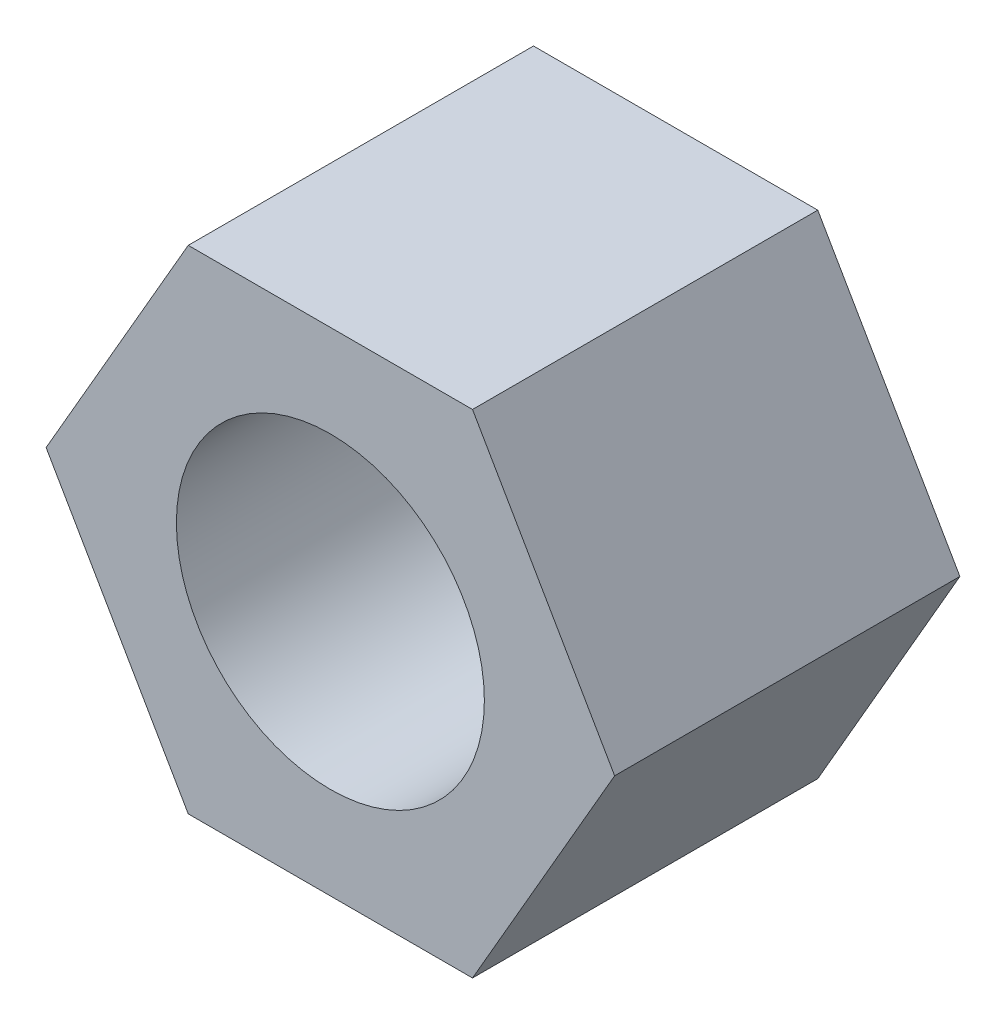
from build123d import *

# Parameters (mm, degrees)
SKETCH1_R           = 3.925
BOSS_EXTRUDE1_DEPTH = 8.8


with BuildPart() as part:
    # Sketch1 → Boss-Extrude1 (new body)
    with BuildSketch(Plane.XY):
        Polygon((3.622872939, -6.275), (7.245745878, 0), (3.622872939, 6.275), (-3.622872939, 6.275), (-7.245745878, 0), (-3.622872939, -6.275), align=None)
        Circle(SKETCH1_R, mode=Mode.SUBTRACT)
    extrude(amount=BOSS_EXTRUDE1_DEPTH)


solid = part.part
